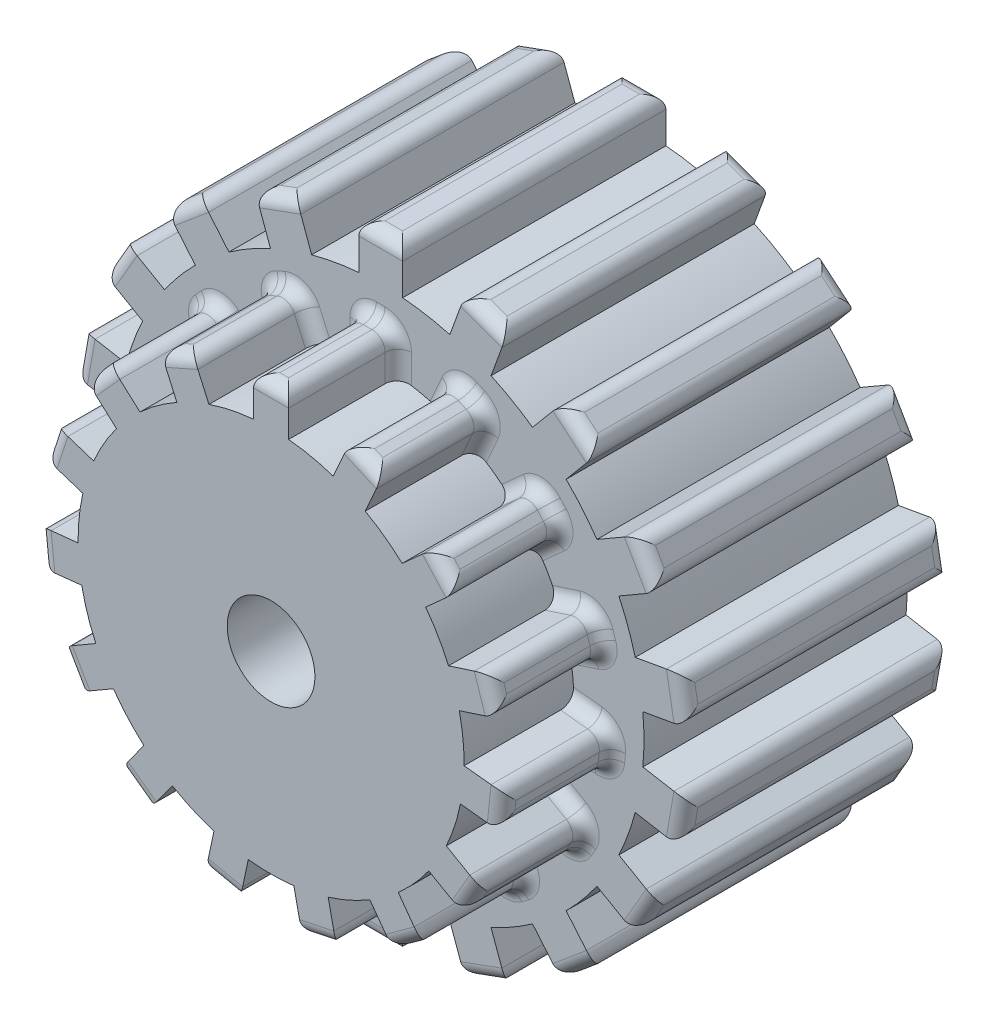
from build123d import *

# Parameters (mm, degrees)
SKETCH2_R                = 60
BOSS_EXTRUDE1_DEPTH      = 60
SKETCH3_W                = 10
SKETCH3_H                = 10.47851478
BOSS_EXTRUDE2_DEPTH      = 60
FILLET2_R                = 3
CIRPATTERN1_COUNT        = 18
FILLET2_OF_CIRPATTERN1_R = 3
SKETCH4_R                = 10
CUT_EXTRUDE1_DEPTH       = 60
SKETCH5_R                = 44
BOSS_EXTRUDE3_DEPTH      = 25
SKETCH6_W                = 8
SKETCH6_H                = 10.044359629
BOSS_EXTRUDE4_DEPTH      = 25
CUT_EXTRUDE2_START       = -90
SKETCH7_R                = 10
CUT_EXTRUDE2_DEPTH       = 90
FILLET3_R                = 3
CIRPATTERN2_COUNT        = 15
FILLET3_OF_CIRPATTERN2_R = 3


with BuildPart() as part:
    # Sketch2 → Boss-Extrude1 (new body)
    with BuildSketch(Plane.XY):
        Circle(SKETCH2_R)
    extrude(amount=BOSS_EXTRUDE1_DEPTH)

    # Sketch3 → Boss-Extrude2 (add)
    with BuildSketch(Plane.XY.offset(60)):
        with Locations((0, 64.76074261)):
            Rectangle(SKETCH3_W, SKETCH3_H)
    boss_extrude2 = extrude(amount=-BOSS_EXTRUDE2_DEPTH)

    # Fillet2
    fillet2_edges = [part.edges().sort_by_distance(p)[0] for p in [
        (5, 70, 30),
        (0, 70, 0),
        (-5, 70, 30),
        (0, 70, 60),
    ]]
    fillet(fillet2_edges, radius=FILLET2_R)

    # CirPattern1: Boss-Extrude2 ×18 about axis
    cirpattern1_axis = Axis((0, 0, 0), (0, 0, 1))
    for i in range(1, CIRPATTERN1_COUNT):
        add(boss_extrude2.rotate(cirpattern1_axis, i * 360 / CIRPATTERN1_COUNT))

    # Fillet2 of CirPattern1
    fillet2_of_cirpattern1_edges = [part.edges().sort_by_distance(p)[0] for p in [
        (-19.242946929, 67.488584172, 30),
        (-23.941410033, 65.778483455, 0),
        (-28.639873137, 64.068382738, 30),
        (-23.941410033, 65.778483455, 60),
        (-41.164910462, 56.837049067, 30),
        (-44.995132678, 53.623111018, 0),
        (-48.825354894, 50.40917297, 30),
        (-44.995132678, 53.623111018, 60),
        (-58.121778265, 39.330127019, 30),
        (-60.621778265, 35, 0),
        (-63.121778265, 30.669872981, 30),
        (-60.621778265, 35, 60),
        (-68.068301823, 17.079411202, 30),
        (-68.936542711, 12.155372437, 0),
        (-69.804783599, 7.231333672, 30),
        (-68.936542711, 12.155372437, 60),
        (-69.804783599, -7.231333672, 30),
        (-68.936542711, -12.155372437, 0),
        (-68.068301823, -17.079411202, 30),
        (-68.936542711, -12.155372437, 60),
        (-63.121778265, -30.669872981, 30),
        (-60.621778265, -35, 0),
        (-58.121778265, -39.330127019, 30),
        (-60.621778265, -35, 60),
        (-48.825354894, -50.40917297, 30),
        (-44.995132678, -53.623111018, 0),
        (-41.164910462, -56.837049067, 30),
        (-44.995132678, -53.623111018, 60),
        (-28.639873137, -64.068382738, 30),
        (-23.941410033, -65.778483455, 0),
        (-19.242946929, -67.488584172, 30),
        (-23.941410033, -65.778483455, 60),
        (-5, -70, 30),
        (0, -70, 0),
        (5, -70, 30),
        (0, -70, 60),
        (19.242946929, -67.488584172, 30),
        (23.941410033, -65.778483455, 0),
        (28.639873137, -64.068382738, 30),
        (23.941410033, -65.778483455, 60),
        (41.164910462, -56.837049067, 30),
        (44.995132678, -53.623111018, 0),
        (48.825354894, -50.40917297, 30),
        (44.995132678, -53.623111018, 60),
        (58.121778265, -39.330127019, 30),
        (60.621778265, -35, 0),
        (63.121778265, -30.669872981, 30),
        (60.621778265, -35, 60),
        (68.068301823, -17.079411202, 30),
        (68.936542711, -12.155372437, 0),
        (69.804783599, -7.231333672, 30),
        (68.936542711, -12.155372437, 60),
        (69.804783599, 7.231333672, 30),
        (68.936542711, 12.155372437, 0),
        (68.068301823, 17.079411202, 30),
        (68.936542711, 12.155372437, 60),
        (63.121778265, 30.669872981, 30),
        (60.621778265, 35, 0),
        (58.121778265, 39.330127019, 30),
        (60.621778265, 35, 60),
        (48.825354894, 50.40917297, 30),
        (44.995132678, 53.623111018, 0),
        (41.164910462, 56.837049067, 30),
        (44.995132678, 53.623111018, 60),
        (28.639873137, 64.068382738, 30),
        (23.941410033, 65.778483455, 0),
        (19.242946929, 67.488584172, 30),
        (23.941410033, 65.778483455, 60),
    ]]
    fillet(fillet2_of_cirpattern1_edges, radius=FILLET2_OF_CIRPATTERN1_R)

    # Sketch4 → Cut-Extrude1 (cut)
    with BuildSketch(Plane.XY.offset(60)):
        Circle(SKETCH4_R)
    extrude(amount=-CUT_EXTRUDE1_DEPTH, mode=Mode.SUBTRACT)

    # Sketch5 → Boss-Extrude3 (add)
    with BuildSketch(Plane.XY.offset(60)):
        Circle(SKETCH5_R)
    extrude(amount=BOSS_EXTRUDE3_DEPTH)

    # Sketch6 → Boss-Extrude4 (add)
    with BuildSketch(Plane.XY.offset(85)):
        with Locations((0, 47.977820186)):
            Rectangle(SKETCH6_W, SKETCH6_H)
    boss_extrude4 = extrude(amount=-BOSS_EXTRUDE4_DEPTH)

    # Sketch7 → Cut-Extrude2 (cut)
    with BuildSketch(Plane(origin=(0, 0, 0), x_dir=(-1, 0, 0), z_dir=(0, 0, -1)).offset(CUT_EXTRUDE2_START)):
        with Locations(Location((0, 0, 0), (0, 0, 180))):
            Circle(SKETCH7_R)
    extrude(amount=CUT_EXTRUDE2_DEPTH, mode=Mode.SUBTRACT)

    # Fillet3
    fillet3_edges = [part.edges().sort_by_distance(p)[0] for p in [
        (-4, 48.4089023, 60),
        (4, 48.4089023, 60),
        (4, 53, 72.5),
        (0, 53, 60),
        (-4, 53, 72.5),
        (0, 53, 85),
    ]]
    fillet(fillet3_edges, radius=FILLET3_R)

    # CirPattern2: Boss-Extrude4 ×15 about axis
    cirpattern2_axis = Axis((0, 0, 0), (0, 0, 1))
    for i in range(1, CIRPATTERN2_COUNT):
        add(boss_extrude4.rotate(cirpattern2_axis, i * 360 / CIRPATTERN2_COUNT))

    # Fillet3 of CirPattern2
    fillet3_of_cirpattern2_edges = [part.edges().sort_by_distance(p)[0] for p in [
        (-23.343856247, 42.596786234, 60),
        (-16.035492586, 45.850679378, 60),
        (-17.902860252, 50.044855827, 72.5),
        (-21.557042083, 48.417909255, 60),
        (-25.211223914, 46.790962683, 72.5),
        (-21.557042083, 48.417909255, 85),
        (-38.651347677, 29.419298847, 60),
        (-33.298302826, 35.364457451, 60),
        (-36.710153325, 38.436501439, 72.5),
        (-39.38667575, 35.463922137, 60),
        (-42.063198176, 32.491342835, 72.5),
        (-39.38667575, 35.463922137, 85),
        (-47.275669957, 11.154947425, 60),
        (-44.803534002, 18.763399555, 60),
        (-49.169927386, 20.182126767, 72.5),
        (-50.405995364, 16.377900702, 60),
        (-51.642063341, 12.573674637, 72.5),
        (-50.405995364, 16.377900702, 85),
        (-47.725599415, -9.038195747, 60),
        (-48.561827121, -1.082020584, 60),
        (-53.127774308, -1.561920972, 72.5),
        (-52.709660455, -5.540008553, 60),
        (-52.291546601, -9.518096135, 72.5),
        (-52.709660455, -5.540008553, 85),
        (-39.923339161, -27.668552765, 60),
        (-43.923339161, -20.740349535, 60),
        (-47.899346401, -23.035898385, 72.5),
        (-45.899346401, -26.5, 60),
        (-43.899346401, -29.964101615, 72.5),
        (-45.899346401, -26.5, 85),
        (-25.217970874, -41.514765649, 60),
        (-31.690106829, -36.812483631, 60),
        (-34.388686349, -40.526759693, 72.5),
        (-31.152618372, -42.877900702, 60),
        (-27.916550394, -45.229041711, 72.5),
        (-31.152618372, -42.877900702, 85),
        (-6.152186325, -48.182698402, 60),
        (-13.977367131, -46.519404876, 60),
        (-14.931910016, -51.010176076, 72.5),
        (-11.019319613, -51.841822839, 60),
        (-7.10672921, -52.673469602, 72.5),
        (-11.019319613, -51.841822839, 85),
        (13.977367131, -46.519404876, 60),
        (6.152186325, -48.182698402, 60),
        (7.10672921, -52.673469602, 72.5),
        (11.019319613, -51.841822839, 60),
        (14.931910016, -51.010176076, 72.5),
        (11.019319613, -51.841822839, 85),
        (31.690106829, -36.812483631, 60),
        (25.217970874, -41.514765649, 60),
        (27.916550394, -45.229041711, 72.5),
        (31.152618372, -42.877900702, 60),
        (34.388686349, -40.526759693, 72.5),
        (31.152618372, -42.877900702, 85),
        (43.923339161, -20.740349535, 60),
        (39.923339161, -27.668552765, 60),
        (43.899346401, -29.964101615, 72.5),
        (45.899346401, -26.5, 60),
        (47.899346401, -23.035898385, 72.5),
        (45.899346401, -26.5, 85),
        (48.561827121, -1.082020584, 60),
        (47.725599415, -9.038195747, 60),
        (52.291546601, -9.518096135, 72.5),
        (52.709660455, -5.540008553, 60),
        (53.127774308, -1.561920972, 72.5),
        (52.709660455, -5.540008553, 85),
        (44.803534002, 18.763399555, 60),
        (47.275669957, 11.154947425, 60),
        (51.642063341, 12.573674637, 72.5),
        (50.405995364, 16.377900702, 60),
        (49.169927386, 20.182126767, 72.5),
        (50.405995364, 16.377900702, 85),
        (33.298302826, 35.364457451, 60),
        (38.651347677, 29.419298847, 60),
        (42.063198176, 32.491342835, 72.5),
        (39.38667575, 35.463922137, 60),
        (36.710153325, 38.436501439, 72.5),
        (39.38667575, 35.463922137, 85),
        (16.035492586, 45.850679378, 60),
        (23.343856247, 42.596786234, 60),
        (25.211223914, 46.790962683, 72.5),
        (21.557042083, 48.417909255, 60),
        (17.902860252, 50.044855827, 72.5),
        (21.557042083, 48.417909255, 85),
    ]]
    fillet(fillet3_of_cirpattern2_edges, radius=FILLET3_OF_CIRPATTERN2_R)


solid = part.part
